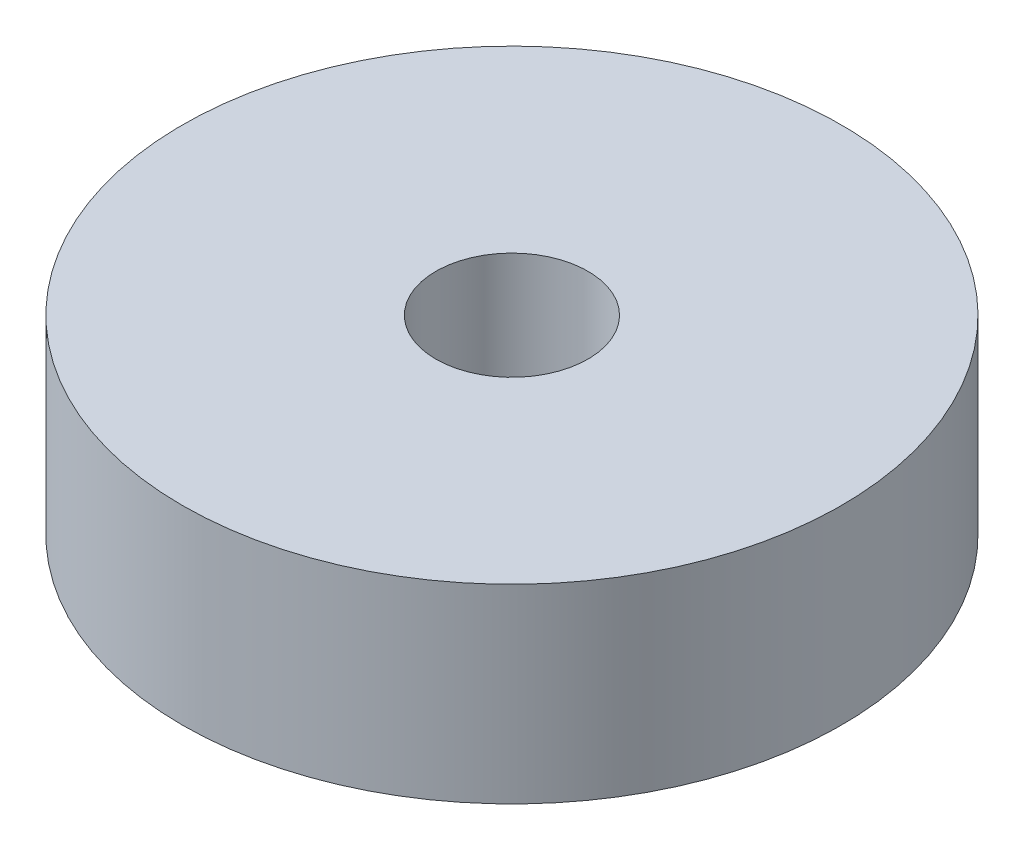
from build123d import *

# Parameters (mm, degrees)
SKETCH1_R           = 11
SKETCH1_R_2         = 2.54
BOSS_EXTRUDE1_DEPTH = 6.35


with BuildPart() as part:
    # Sketch1 → Boss-Extrude1 (new body)
    with BuildSketch(Plane(origin=(0, 0, 0), x_dir=(1, 0, 0), z_dir=(0, 1, 0))):
        with Locations(Location((0, 0, 0), (0, 0, 270))):
            Circle(SKETCH1_R)
        with Locations(Location((0, 0, 0), (0, 0, 270))):
            Circle(SKETCH1_R_2, mode=Mode.SUBTRACT)
    extrude(amount=BOSS_EXTRUDE1_DEPTH)


solid = part.part
